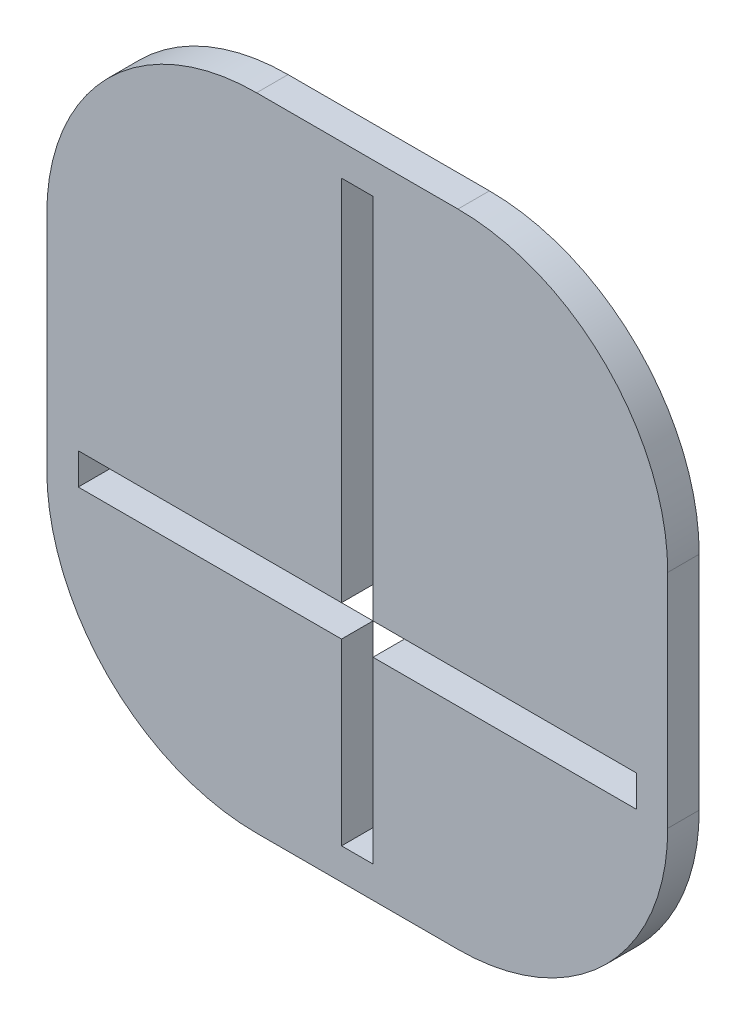
from build123d import *

# Parameters (mm, degrees)
SALIENTE_EXTRUIR1_DEPTH = 3


with BuildPart() as part:
    # Croquis1 → Saliente-Extruir1 (new body)
    with BuildSketch(Plane.XY):
        with BuildLine():
            Line((-9.6, -30.565), (9.6, -30.565))
            ThreePointArc((9.6, -30.565), (23.742135624, -24.707135624), (29.6, -10.565))
            Line((29.6, -10.565), (29.6, 10.565))
            ThreePointArc((29.6, 10.565), (23.742135624, 24.707135624), (9.6, 30.565))
            Line((9.6, 30.565), (-9.6, 30.565))
            ThreePointArc((-9.6, 30.565), (-23.742135624, 24.707135624), (-29.6, 10.565))
            Line((-29.6, 10.565), (-29.6, -10.565))
            ThreePointArc((-29.6, -10.565), (-23.742135624, -24.707135624), (-9.6, -30.565))
        make_face()
        Polygon((-26.6, -10.49), (-26.6, -7.49), (-1.5, -7.49), (-1.5, 27.565), (1.5, 27.565), (1.5, -7.49), (26.6, -7.49), (26.6, -10.49), (1.5, -10.49), (1.5, -27.565), (-1.5, -27.565), (-1.5, -10.49), align=None, mode=Mode.SUBTRACT)
    extrude(amount=SALIENTE_EXTRUIR1_DEPTH)


solid = part.part
